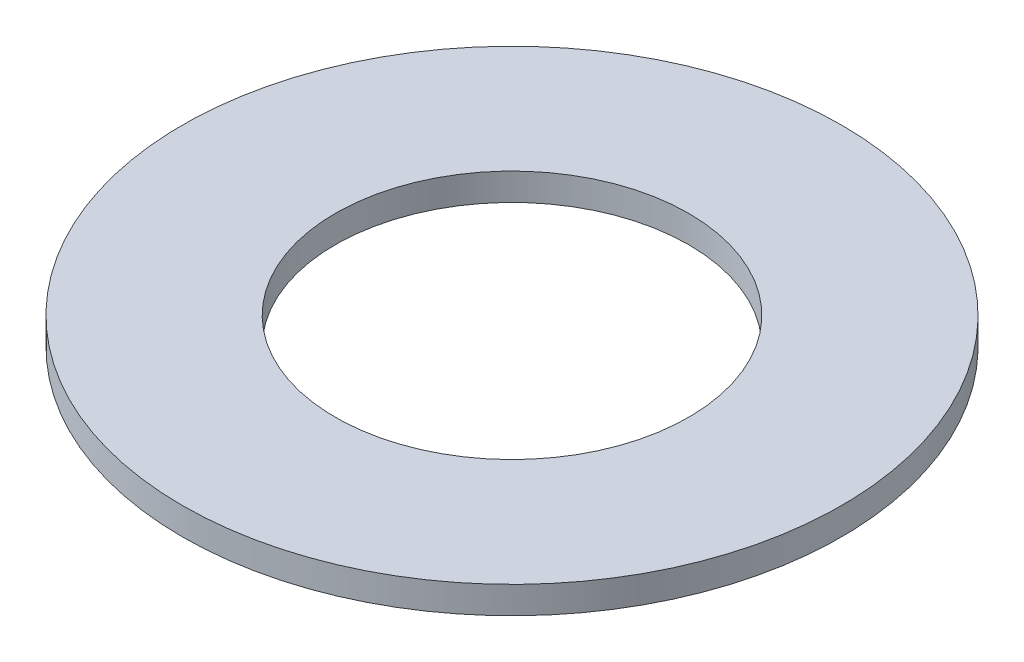
from build123d import *

# Parameters (mm, degrees)
SCHIZZO1_W = 22.5
SCHIZZO1_H = 4


with BuildPart() as part:
    # Schizzo1 → Rivoluzione1 (revolve)
    with BuildSketch(Plane.XY, mode=Mode.PRIVATE) as rivoluzione1_sk:
        with Locations((-37.25, 2)):
            Rectangle(SCHIZZO1_W, SCHIZZO1_H)
    revolve(rivoluzione1_sk.sketch.rotate(Axis((0, 0, 0), (0, 1, 0)), 270), axis=Axis((0, 0, 0), (0, 1, 0)))


solid = part.part
